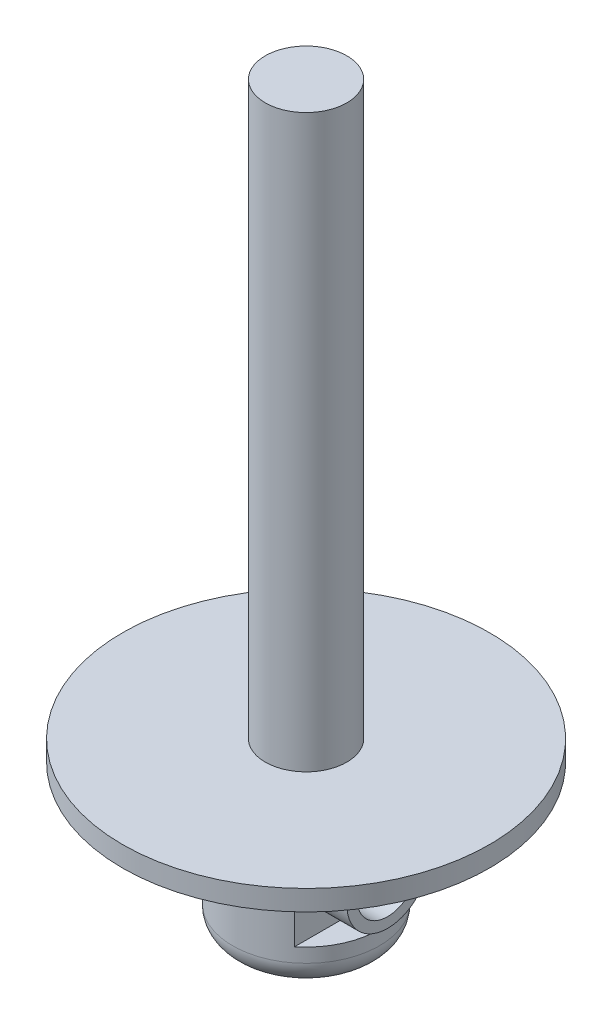
from build123d import *

# Parameters (mm, degrees)
SKETCH1_R               = 45
BOSS_EXTRUDE1_DEPTH     = 5
SKETCH2_R               = 10
BOSS_EXTRUDE2_DEPTH     = 140
SKETCH3_R               = 18
BOSS_EXTRUDE3_DEPTH     = 36
FILLET1_R               = 6
CUT_EXTRUDE1_DEPTH      = 159.350876221
CUT_EXTRUDE1_DEPTH_BACK = 159.350876221
SKETCH4_W               = 21.648814377
SKETCH4_H               = 22.5
SKETCH5_R               = 7.5
CUT_EXTRUDE2_DEPTH      = 162.907573943
SKETCH7_R               = 10
SKETCH7_R_2             = 7.5
BOSS_EXTRUDE4_DEPTH     = 20


with BuildPart() as part:
    # Sketch1 → Boss-Extrude1 (new body)
    with BuildSketch(Plane(origin=(0, 0, 0), x_dir=(1, 0, 0), z_dir=(0, 1, 0))):
        with Locations(Location((0, 0, 0), (0, 0, 270))):
            Circle(SKETCH1_R)
    extrude(amount=BOSS_EXTRUDE1_DEPTH)

    # Sketch2 → Boss-Extrude2 (add)
    with BuildSketch(Plane(origin=(0, 5, 0), x_dir=(1, 0, 0), z_dir=(0, 1, 0))):
        with Locations(Location((0, 0, 0), (0, 0, 270))):
            Circle(SKETCH2_R)
    extrude(amount=BOSS_EXTRUDE2_DEPTH)

    # Sketch3 → Boss-Extrude3 (add)
    with BuildSketch(Plane.XZ):
        with Locations(Location((0, 0, 0), (0, 0, 270))):
            Circle(SKETCH3_R)
    extrude(amount=BOSS_EXTRUDE3_DEPTH)

    # Fillet1
    fillet1_edges = [part.edges().sort_by_distance(p)[0] for p in [
        (0, -36, 18),
    ]]
    fillet(fillet1_edges, radius=FILLET1_R)

    # Sketch4 → Cut-Extrude1 (cut, two sides: drawn at the far end of the back side and taken through both)
    with BuildSketch(Plane.XY.offset(-CUT_EXTRUDE1_DEPTH_BACK)):
        with Locations((22.074407189, -15.296408269)):
            Rectangle(SKETCH4_W, SKETCH4_H)
        with Locations((-22.074407189, -15.296408269)):
            Rectangle(SKETCH4_W, SKETCH4_H)
    extrude(amount=CUT_EXTRUDE1_DEPTH + CUT_EXTRUDE1_DEPTH_BACK, mode=Mode.SUBTRACT)

    # Sketch5 → Cut-Extrude2 (cut, through all)
    with BuildSketch(Plane(origin=(11.25, 0, 0), x_dir=(0, 0, -1), z_dir=(1, 0, 0))):
        with Locations(Location((0, -15.296408269, 0), (0, 0, 90))):
            Circle(SKETCH5_R)
    extrude(amount=-CUT_EXTRUDE2_DEPTH, mode=Mode.SUBTRACT)

    # Sketch7 → Boss-Extrude4 (add, symmetric)
    with BuildSketch(Plane(origin=(0, 0, 0), x_dir=(0, 0, -1), z_dir=(1, 0, 0))):
        with Locations(Location((0, -15.296408269, 0), (0, 0, 90))):
            Circle(SKETCH7_R)
        with Locations(Location((0, -15.296408269, 0), (0, 0, 90))):
            Circle(SKETCH7_R_2, mode=Mode.SUBTRACT)
    extrude(amount=BOSS_EXTRUDE4_DEPTH, both=True)


solid = part.part
